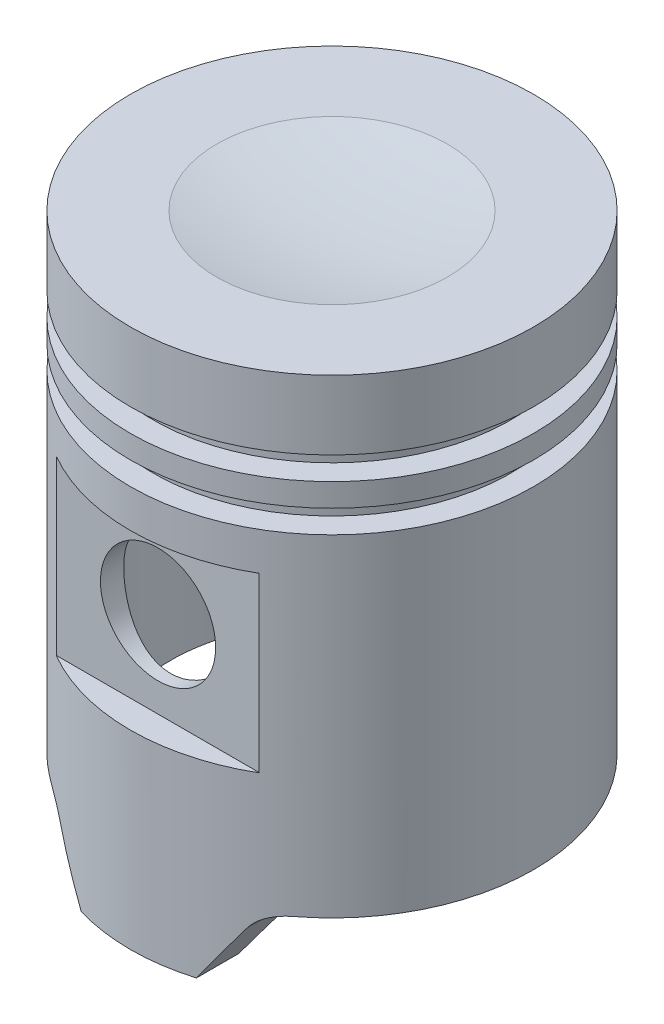
from build123d import *

# Parameters (mm, degrees)
CUT_EXTRUDE1_DEPTH      = 68.23495628
CUT_EXTRUDE1_DEPTH_BACK = 68.23495628
SKETCH3_R               = 17.78
CUT_EXTRUDE2_DEPTH      = 51.816
CUT_EXTRUDE3_DEPTH      = 68.234956346
CUT_EXTRUDE3_DEPTH_BACK = 68.234956346
SKETCH4_R               = 6.35
CUT_EXTRUDE4_START      = 22.225
SKETCH5_W               = 22.352
SKETCH5_H               = 19.05
CUT_EXTRUDE4_DEPTH      = 3.048


with BuildPart() as part:
    # Sketch1 → Revolve1 (revolve)
    with BuildSketch(Plane.XY, mode=Mode.PRIVATE) as revolve1_sk:
        with BuildLine():
            Line((0, 0), (0, 58.166))
            ThreePointArc((0, 58.166), (6.387986381, 58.484288237), (12.712693656, 59.436))
            Line((12.712693656, 59.436), (22.225, 59.436))
            Line((22.225, 59.436), (22.225, 51.816))
            Line((22.225, 51.816), (19.685, 51.816))
            Line((19.685, 51.816), (19.685, 49.276))
            Line((19.685, 49.276), (22.225, 49.276))
            Line((22.225, 49.276), (22.225, 46.736))
            Line((22.225, 46.736), (19.685, 46.736))
            Line((19.685, 46.736), (19.685, 44.196))
            Line((19.685, 44.196), (22.225, 44.196))
            Line((22.225, 44.196), (22.225, 0))
            Line((22.225, 0), (0, 0))
        make_face()
    revolve(revolve1_sk.sketch.rotate(Axis((0, 59.436, 0), (0, 1, 0)), 90), axis=Axis((0, 59.436, 0), (0, 1, 0)))

    # Sketch2 → Cut-Extrude1 (cut, two sides: drawn at the far end of the back side and taken through both)
    with BuildSketch(Plane.XY.offset(-CUT_EXTRUDE1_DEPTH_BACK)):
        with BuildLine():
            Line((22.225, 0), (22.225, 7.62))
            Line((22.225, 7.62), (13.470533586, 7.62))
            ThreePointArc((13.470533586, 7.62), (11.673046061, 7.169336035), (10.300788381, 5.923957269))
            Line((10.300788381, 5.923957269), (6.35, 0))
            Line((6.35, 0), (22.225, 0))
        make_face()
        with BuildLine():
            Line((-22.225, 0), (-22.225, 7.62))
            Line((-22.225, 7.62), (-13.470533586, 7.62))
            ThreePointArc((-13.470533586, 7.62), (-11.673046061, 7.169336035), (-10.300788381, 5.923957269))
            Line((-10.300788381, 5.923957269), (-6.35, 0))
            Line((-6.35, 0), (-22.225, 0))
        make_face()
    extrude(amount=CUT_EXTRUDE1_DEPTH + CUT_EXTRUDE1_DEPTH_BACK, mode=Mode.SUBTRACT)

    # Sketch3 → Cut-Extrude2 (cut)
    with BuildSketch(Plane.XZ):
        with Locations(Location((0, 0, 0), (0, 0, 270))):
            Circle(SKETCH3_R)
    extrude(amount=-CUT_EXTRUDE2_DEPTH, mode=Mode.SUBTRACT)

    # Sketch4 → Cut-Extrude3 (cut, two sides: drawn at the far end of the back side and taken through both)
    with BuildSketch(Plane.XY.offset(-CUT_EXTRUDE3_DEPTH_BACK)):
        with Locations((0, 30.48)):
            Circle(SKETCH4_R)
    extrude(amount=CUT_EXTRUDE3_DEPTH + CUT_EXTRUDE3_DEPTH_BACK, mode=Mode.SUBTRACT)

    # Sketch5 → Cut-Extrude4 (cut)
    with BuildSketch(Plane.XY.offset(CUT_EXTRUDE4_START)):
        with Locations((0, 30.48)):
            Rectangle(SKETCH5_W, SKETCH5_H)
    extrude(amount=-CUT_EXTRUDE4_DEPTH, mode=Mode.SUBTRACT)


solid = part.part
